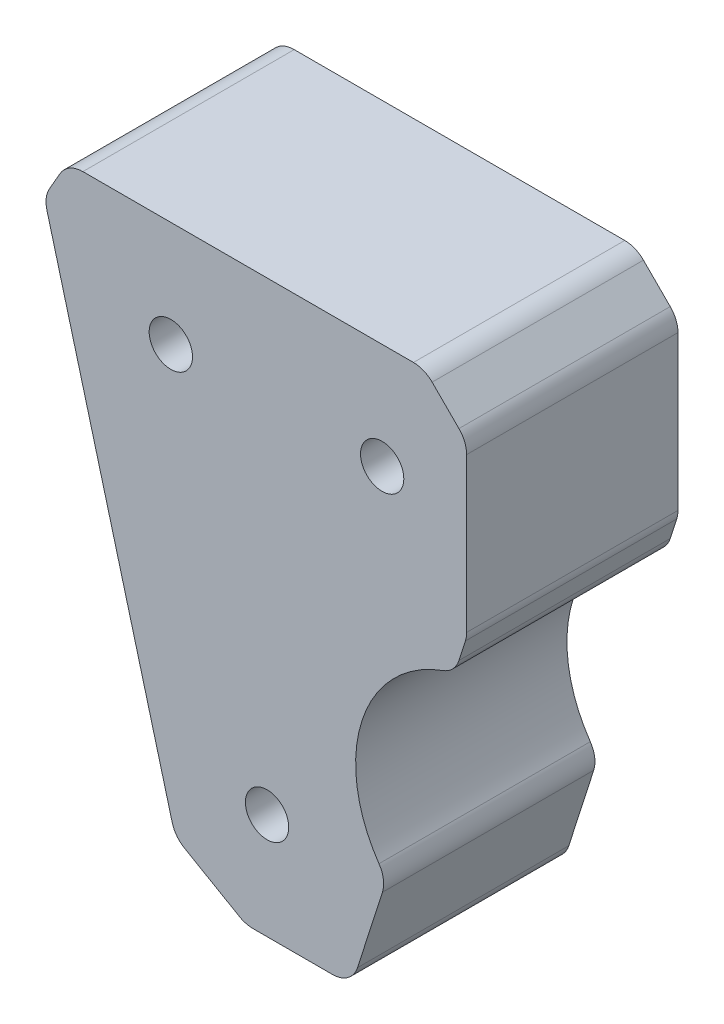
from build123d import *
from OCP.BRepFilletAPI import BRepFilletAPI_MakeChamfer

# Parameters (mm, degrees)
SKETCH_1_R          = 2.05
EXTRUDE_1_DEPTH     = 10
CHAMFER_1_SIZE      = 4
CHAMFER_1_SIZE2     = 5.656854249
CHAMFER_1_SIZE2_2   = 3.265986324
SKETCH_2_R          = 12.5
CUT_EXTRUDE_1_DEPTH = 56.856960175
FILLET_1_R          = 2.5


with BuildPart() as part:
    # 草图1 → 凸台-拉伸1 (new, symmetric)
    with BuildSketch(Plane.XY):
        Polygon((-13.032253728, 10), (1.437002663, -44), (17.110272543, -44), (28, -10), (28, 10), align=None)
        Circle(SKETCH_1_R, mode=Mode.SUBTRACT)
        with Locations((20, 0)):
            Circle(SKETCH_1_R, mode=Mode.SUBTRACT)
        with Locations((9.110272543, -34)):
            Circle(SKETCH_1_R, mode=Mode.SUBTRACT)
    extrude(amount=EXTRUDE_1_DEPTH, both=True)

    # 倒角1: one chamfer whose edges measure the first distance from different faces: ONE call of the kernel's chamfer builder (chamfer() names one face for all edges)
    chamfer_1_edges_1 = [part.edges().sort_by_distance(p)[0] for p in [
        (1.437002663, -44, 0),
    ]]
    chamfer_1_side_1 = [part.faces().sort_by_distance(p)[0] for p in [
        (-5.797625533, -17, 0),
    ]]
    chamfer_1_edges_2 = [part.edges().sort_by_distance(p)[0] for p in [
        (-13.032253728, 10, 0),
    ]]
    chamfer_1_side_2 = [part.faces().sort_by_distance(p)[0] for p in [
        (-5.797625533, -17, 0),
    ]]
    chamfer_1_edges_3 = [part.edges().sort_by_distance(p)[0] for p in [
        (28, 10, 0),
    ]]
    chamfer_1 = BRepFilletAPI_MakeChamfer(part.part.solid().wrapped)
    for e in chamfer_1_edges_1:
        chamfer_1.Add(CHAMFER_1_SIZE, CHAMFER_1_SIZE2, e.wrapped, chamfer_1_side_1[0].wrapped)  # the first distance lies on this face
    for e in chamfer_1_edges_2:
        chamfer_1.Add(CHAMFER_1_SIZE, CHAMFER_1_SIZE2_2, e.wrapped, chamfer_1_side_2[0].wrapped)  # the first distance lies on this face
    for e in chamfer_1_edges_3:
        chamfer_1.Add(CHAMFER_1_SIZE, e.wrapped)
    add(Compound.cast(chamfer_1.Shape()), mode=Mode.REPLACE)

    # 草图2 → 切除-拉伸1 (cut, through all)
    with BuildSketch(Plane.XY.offset(10)):
        with Locations((29.991739345, -25.62060001)):
            Circle(SKETCH_2_R)
    extrude(amount=-CUT_EXTRUDE_1_DEPTH, mode=Mode.SUBTRACT)

    # 圆角1
    fillet_1_edges = [part.edges().sort_by_distance(p)[0] for p in [
        (-9.766267405, 10, 0),
        (24, 10, 0),
        (28, 6, 0),
        (0.401726482, -40.136296695, 0),
        (-11.996977548, 6.136296695, 0),
        (7.093856912, -44, 0),
        (26.873983288, -13.515658987, 0),
        (20.421472383, -33.661743602, 0),
        (17.110272543, -44, 0),
        (28, -10, 0),
    ]]
    fillet(fillet_1_edges, radius=FILLET_1_R)


solid = part.part
